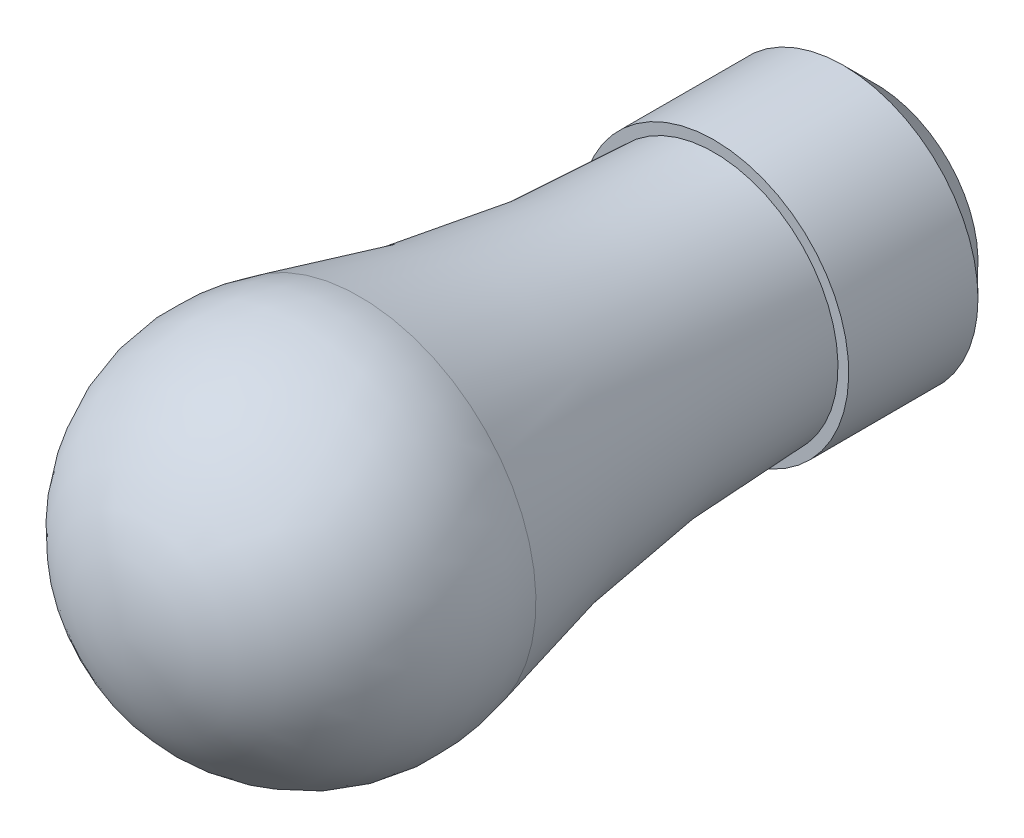
from build123d import *

# Parameters (mm, degrees)
SKETCH1_W     = 15
SKETCH1_H     = 12.5
CHAMFER1_SIZE = 3


with BuildPart() as part:
    # Sketch1 → Revolve1 (revolve)
    with BuildSketch(Plane(origin=(0, 0, 0), x_dir=(0, 0, -1), z_dir=(1, 0, 0)), mode=Mode.PRIVATE) as revolve1_sk:
        with Locations((-7.5, -6.25)):
            Rectangle(SKETCH1_W, SKETCH1_H)
    revolve(revolve1_sk.sketch.rotate(Axis((0, 0, 0), (0, 0, 1)), 180), axis=Axis((0, 0, 0), (0, 0, 1)))

    # Chamfer1
    chamfer1_edges = [part.edges().sort_by_distance(p)[0] for p in [
        (0, -12.5, 0),
    ]]
    chamfer(chamfer1_edges, length=CHAMFER1_SIZE)


with BuildPart() as body_2:
    # Sketch2 → Revolve2 (revolve)
    with BuildSketch(Plane(origin=(0, 0, 0), x_dir=(0, 0, -1), z_dir=(1, 0, 0))):
        with BuildLine():
            Line((-15, 0), (-15, -11.5))
            ThreePointArc((-15, -11.5), (-31.641485331, -12.726231628), (-47.923501777, -16.378438967))
            ThreePointArc((-47.923501777, -16.378438967), (-63.083049036, -13.744317342), (-70, 0))
            Line((-70, 0), (-15, 0))
        make_face()
    revolve(axis=Axis((0, 0, 70), (0, 0, -1)))


solid = Compound([part.part, body_2.part])
